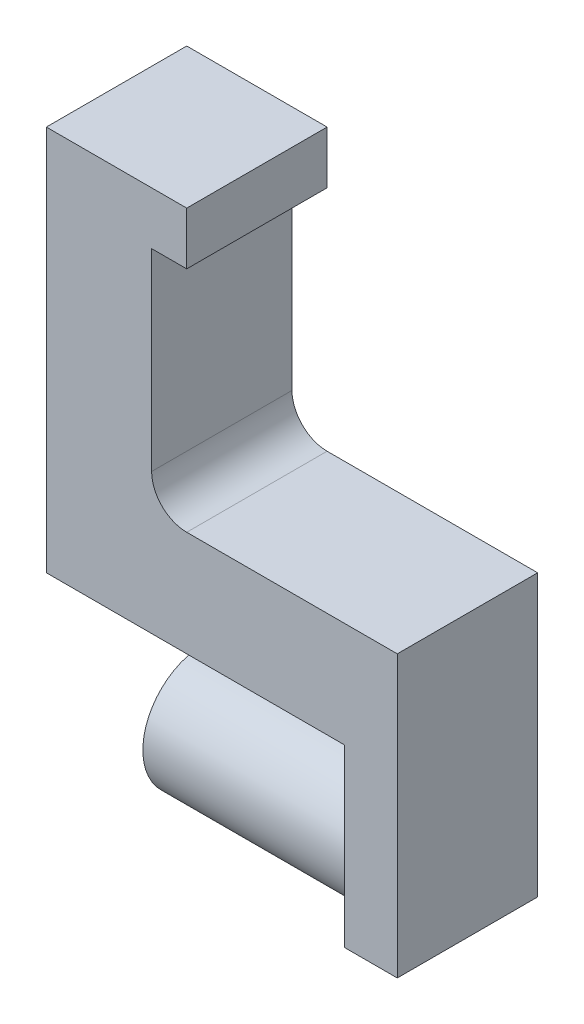
from build123d import *

# Parameters (mm, degrees)
SKETCH1_R                = 11.1125
BOSS_EXTRUDE1_DEPTH      = 38.1
BOSS_EXTRUDE2_DEPTH      = 12.7
BOSS_EXTRUDE2_DEPTH_BACK = 12.7
SKETCH2_W                = 9.525
SKETCH2_H                = 31.75
BOSS_EXTRUDE3_DEPTH      = 12.7
BOSS_EXTRUDE3_DEPTH_BACK = 12.7
SKETCH3_W                = 63.5
SKETCH3_H                = 19.05
BOSS_EXTRUDE4_DEPTH      = 12.7
BOSS_EXTRUDE4_DEPTH_BACK = 12.7
SKETCH4_W                = 19.05
SKETCH4_H                = 69.85
BOSS_EXTRUDE5_DEPTH      = 12.7
BOSS_EXTRUDE5_DEPTH_BACK = 12.7
FILLET1_R                = 6.35


with BuildPart() as part:
    # Sketch1 → Boss-Extrude1 (new body)
    with BuildSketch(Plane(origin=(0, 0, 0), x_dir=(0, 0, -1), z_dir=(1, 0, 0))):
        Circle(SKETCH1_R)
    extrude(amount=-BOSS_EXTRUDE1_DEPTH)

    # Sketch2 → Boss-Extrude2 (add, two sides: drawn at the far end of the back side and taken through both)
    with BuildSketch(Plane.XY.offset(-BOSS_EXTRUDE2_DEPTH_BACK)):
        with Locations((4.7625, 4.7625)):
            Rectangle(SKETCH2_W, SKETCH2_H)
    extrude(amount=BOSS_EXTRUDE2_DEPTH + BOSS_EXTRUDE2_DEPTH_BACK)

    # Sketch3 → Boss-Extrude3 (add, two sides: drawn at the far end of the back side and taken through both)
    with BuildSketch(Plane.XY.offset(-BOSS_EXTRUDE3_DEPTH_BACK)):
        with Locations((-22.225, 30.1625)):
            Rectangle(SKETCH3_W, SKETCH3_H)
    extrude(amount=BOSS_EXTRUDE3_DEPTH + BOSS_EXTRUDE3_DEPTH_BACK)

    # Sketch4 → Boss-Extrude4 (add, two sides: drawn at the far end of the back side and taken through both)
    with BuildSketch(Plane.XY.offset(-BOSS_EXTRUDE4_DEPTH_BACK)):
        with Locations((-44.45, 55.5625)):
            Rectangle(SKETCH4_W, SKETCH4_H)
    extrude(amount=BOSS_EXTRUDE4_DEPTH + BOSS_EXTRUDE4_DEPTH_BACK)

    # Sketch5 → Boss-Extrude5 (add, two sides: drawn at the far end of the back side and taken through both)
    with BuildSketch(Plane.XY.offset(-BOSS_EXTRUDE5_DEPTH_BACK)):
        Polygon((-53.975, 77.7875), (-41.23944, 77.7875), (-41.23944, 80.9625), (-28.575, 80.9625), (-28.575, 90.4875), (-53.975, 90.4875), align=None)
    extrude(amount=BOSS_EXTRUDE5_DEPTH + BOSS_EXTRUDE5_DEPTH_BACK)

    # Fillet1
    fillet1_edges = [part.edges().sort_by_distance(p)[0] for p in [
        (-34.925, 39.6875, 0),
    ]]
    fillet(fillet1_edges, radius=FILLET1_R)


solid = part.part
